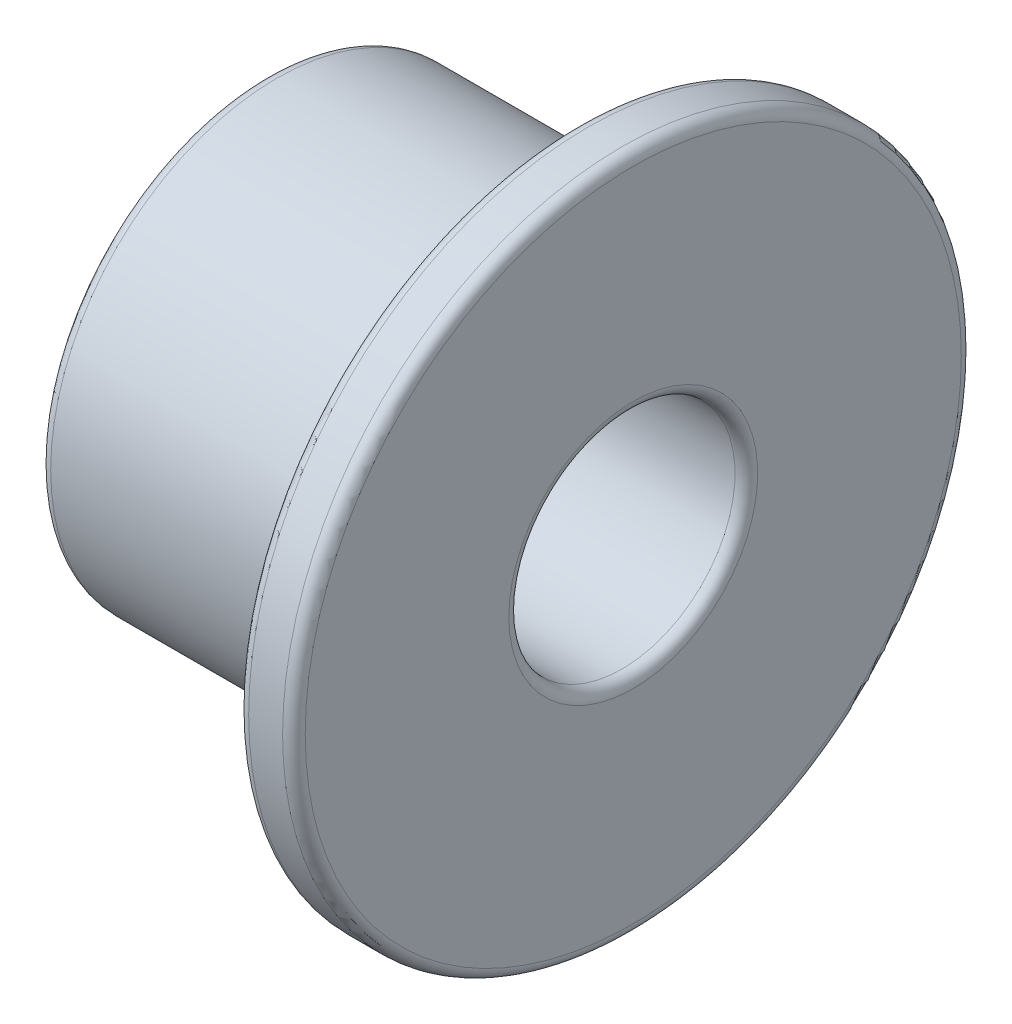
from build123d import *

# Parameters (mm, degrees)
CONG_1_R = 0.2


with BuildPart() as part:
    # Esquisse1 → Révolution1 (revolve)
    with BuildSketch(Plane.XY, mode=Mode.PRIVATE) as r_volution1_sk:
        Polygon((0, 2), (6.5, 2), (6.5, 6), (5.5, 6), (5.5, 4), (0, 4), align=None)
    revolve(r_volution1_sk.sketch.rotate(Axis((0, 0, 0), (1, 0, 0)), 270), axis=Axis((0, 0, 0), (1, 0, 0)))

    # Congé1
    cong_1_edges = [part.edges().sort_by_distance(p)[0] for p in [
        (0, 0, 2),
        (6.5, 0, 2),
        (6.5, 0, 6),
        (5.5, 0, 6),
        (5.5, 0, 4),
        (0, 0, 4),
    ]]
    fillet(cong_1_edges, radius=CONG_1_R)


solid = part.part
